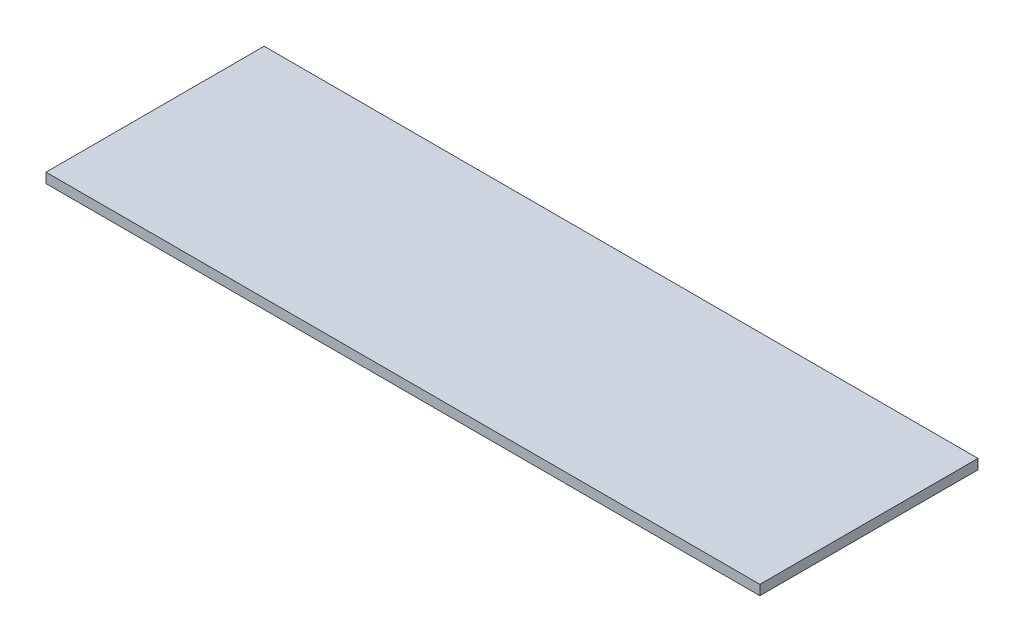
from build123d import *

# Parameters (mm, degrees)
SKETCH1_W           = 228.6
SKETCH1_H           = 69.85
BOSS_EXTRUDE1_DEPTH = 3.175


with BuildPart() as part:
    # Sketch1 → Boss-Extrude1 (new body)
    with BuildSketch(Plane(origin=(0, 0, 0), x_dir=(1, 0, 0), z_dir=(0, 1, 0))):
        Rectangle(SKETCH1_W, SKETCH1_H)
    extrude(amount=BOSS_EXTRUDE1_DEPTH)


solid = part.part
